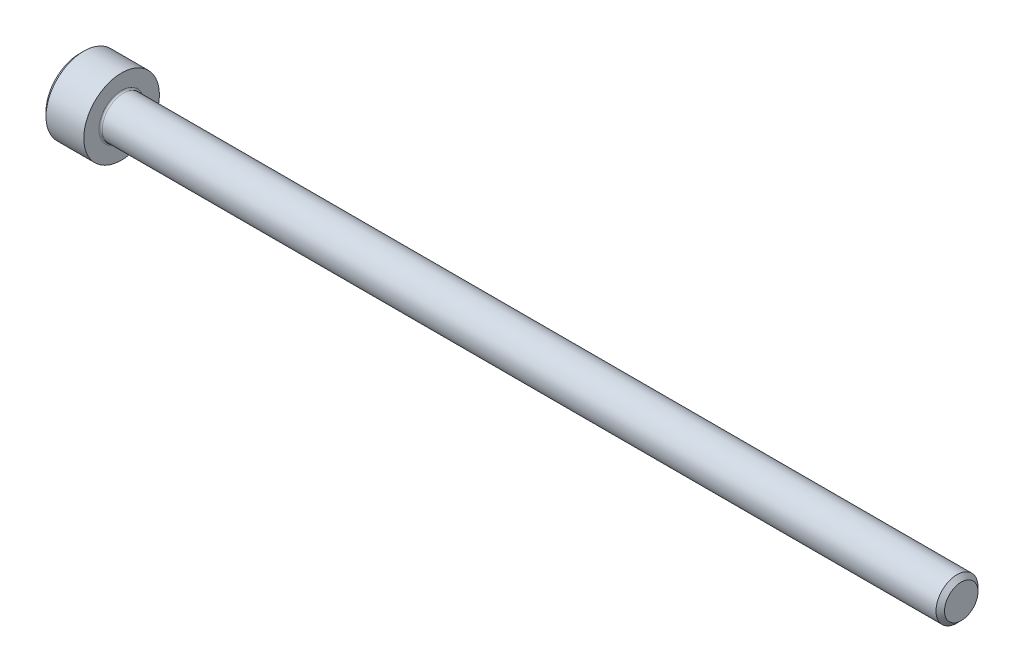
from build123d import *

# Parameters (mm, degrees)
FILLET1_R   = 0.1
HEX_2_DEPTH = 1.1


with BuildPart() as part:
    # BodySke → Base-Revolve (revolve)
    with BuildSketch(Plane.XY, mode=Mode.PRIVATE) as base_revolve_sk:
        Polygon((0, 0), (0, 2), (0.25, 2.25), (2.5, 2.25), (2.5, 1.25), (52.2465, 1.25), (52.5, 0.9965), (52.5, 0), align=None)
    revolve(base_revolve_sk.sketch.rotate(Axis((-31.75, 0, 0), (1, 0, 0)), 90), axis=Axis((-31.75, 0, 0), (1, 0, 0)))

    # Fillet1
    fillet1_edges = [part.edges().sort_by_distance(p)[0] for p in [
        (2.5, 0, -1.25),
    ]]
    fillet(fillet1_edges, radius=FILLET1_R)

    # Sketch2 → Hex-PreBroach (revolve, cut)
    with BuildSketch(Plane.XY, mode=Mode.PRIVATE) as hex_prebroach_sk:
        Polygon((0, 1.0225), (1.1, 1.0225), (1.69034065, 0), (0, 0), align=None)
    revolve(hex_prebroach_sk.sketch.rotate(Axis((0, 0, 0), (1, 0, 0)), 90), axis=Axis((0, 0, 0), (1, 0, 0)), mode=Mode.SUBTRACT)

    # Sketch3 → Hex 2 (cut)
    with BuildSketch(Plane(origin=(0, 0, 0), x_dir=(0, 0.500000000000001, 0.866025403784438), z_dir=(-1, 0, 0))):
        Polygon((0.59034065, 1.0225), (-0.59034065, 1.0225), (-1.1806813, 0), (-0.59034065, -1.0225), (0.59034065, -1.0225), (1.1806813, 0), align=None)
    extrude(amount=-HEX_2_DEPTH, mode=Mode.SUBTRACT)


solid = part.part
